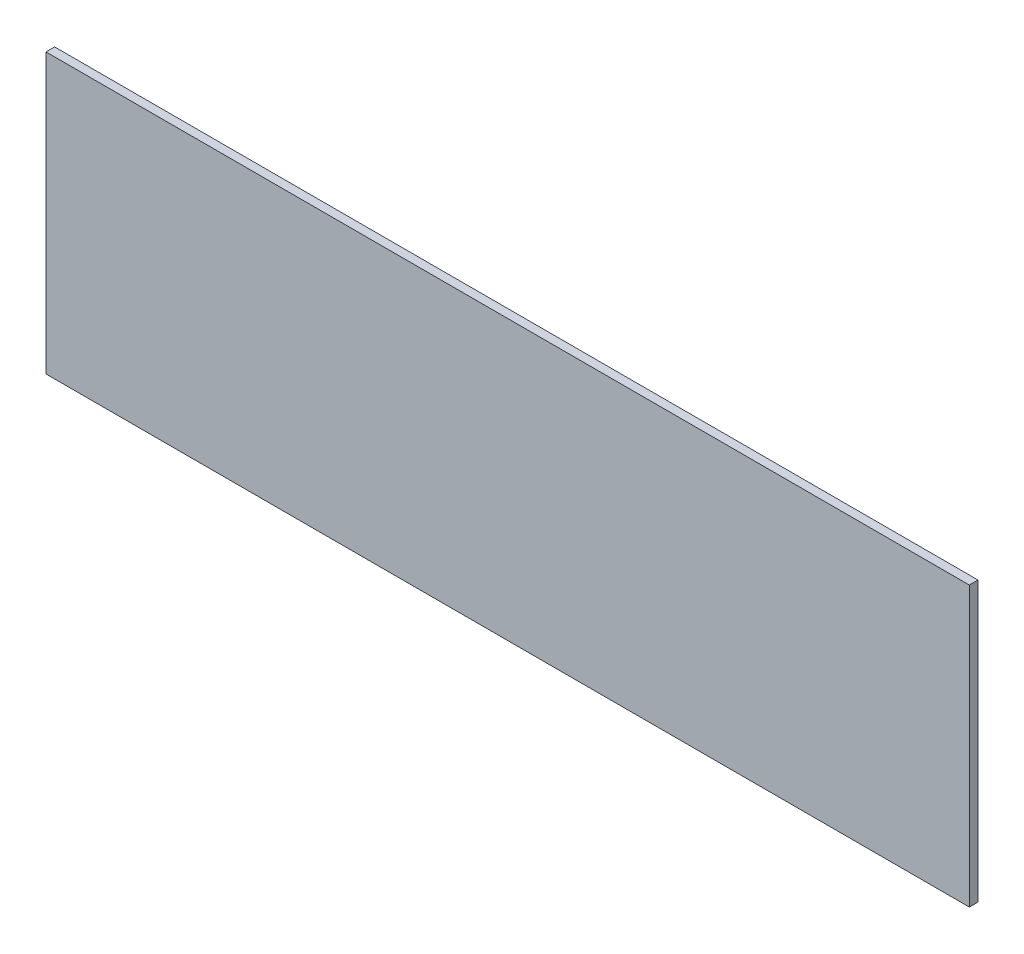
from build123d import *

# Parameters (mm, degrees)
SKETCH1_W           = 960
SKETCH1_H           = 290
BOSS_EXTRUDE1_DEPTH = 9


with BuildPart() as part:
    # Sketch1 → Boss-Extrude1 (new body)
    with BuildSketch(Plane.XY):
        Rectangle(SKETCH1_W, SKETCH1_H)
    extrude(amount=BOSS_EXTRUDE1_DEPTH)


solid = part.part
